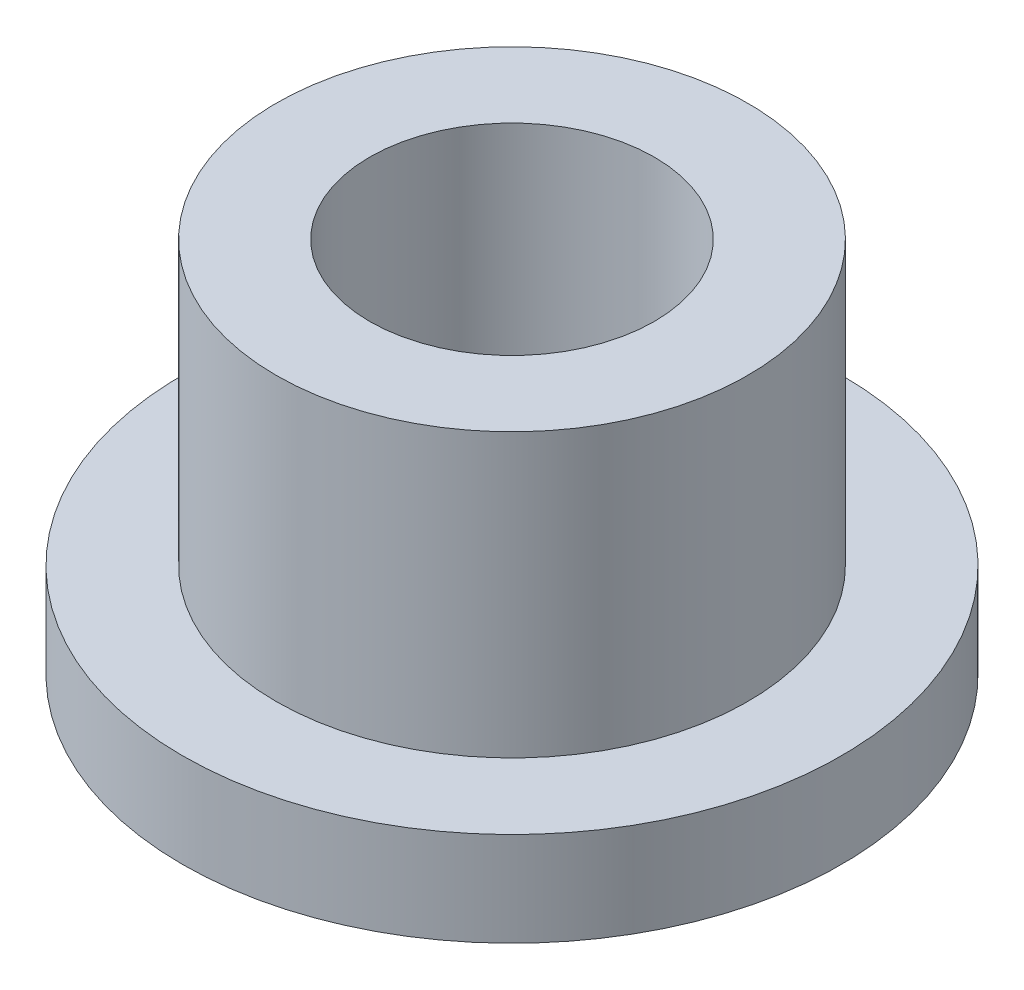
from build123d import *

# Parameters (mm, degrees)
SKETCH2_R           = 3.9751
SKETCH2_R_2         = 2.4003
BOSS_EXTRUDE1_DEPTH = 6.35
SKETCH3_R           = 5.55625
SKETCH3_R_2         = 3.9751
BOSS_EXTRUDE2_DEPTH = 1.5875


with BuildPart() as part:
    # Sketch2 → Boss-Extrude1 (new body)
    with BuildSketch(Plane(origin=(0, 0, 0), x_dir=(1, 0, 0), z_dir=(0, 1, 0))):
        with Locations(Location((0, 0, 0), (0, 0, 270))):
            Circle(SKETCH2_R)
        with Locations(Location((0, 0, 0), (0, 0, 270))):
            Circle(SKETCH2_R_2, mode=Mode.SUBTRACT)
    extrude(amount=BOSS_EXTRUDE1_DEPTH)

    # Sketch3 → Boss-Extrude2 (add)
    with BuildSketch(Plane(origin=(0, 0, 0), x_dir=(1, 0, 0), z_dir=(0, 1, 0))):
        with Locations(Location((0, 0, 0), (0, 0, 270))):
            Circle(SKETCH3_R)
        with Locations(Location((0, 0, 0), (0, 0, 270))):
            Circle(SKETCH3_R_2, mode=Mode.SUBTRACT)
    extrude(amount=BOSS_EXTRUDE2_DEPTH)


solid = part.part
